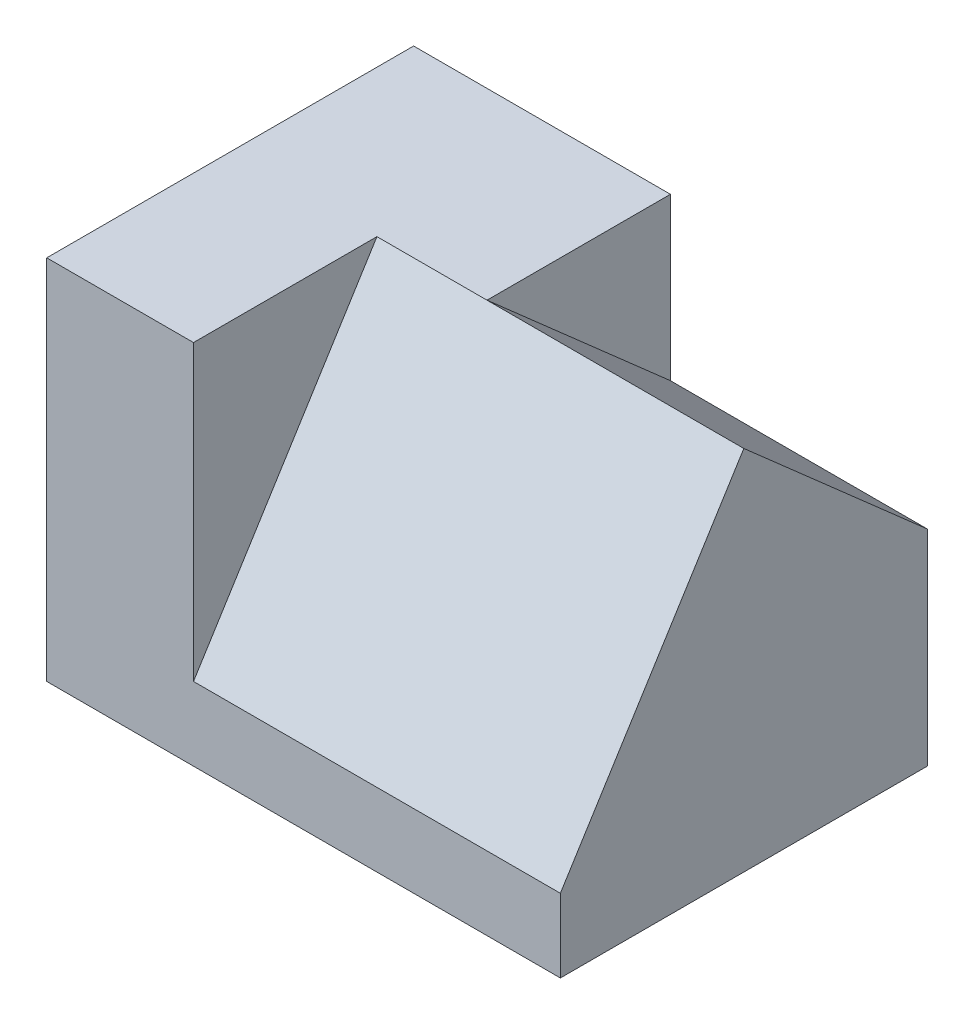
from build123d import *

# Parameters (mm, degrees)
SKETCH1_W               = 1778
SKETCH1_H               = 1270
BOSS_EXTRUDE1_DEPTH     = 1270
CUT_EXTRUDE1_DEPTH      = 2528.268090251
CUT_EXTRUDE1_DEPTH_BACK = 1270
CUT_EXTRUDE2_DEPTH      = 2528.268090251
CUT_EXTRUDE2_DEPTH_BACK = 889


with BuildPart() as part:
    # Sketch1 → Boss-Extrude1 (new body)
    with BuildSketch(Plane(origin=(0, 0, 0), x_dir=(1, 0, 0), z_dir=(0, 1, 0))):
        with Locations((889, 635)):
            Rectangle(SKETCH1_W, SKETCH1_H)
    extrude(amount=BOSS_EXTRUDE1_DEPTH)

    # Sketch2 → Cut-Extrude1 (cut, two sides: drawn at the far end of the back side and taken through both)
    with BuildSketch(Plane(origin=(1778, 0, 0), x_dir=(0, 0, -1), z_dir=(1, 0, 0)).offset(-CUT_EXTRUDE1_DEPTH_BACK)):
        Polygon((0, 254), (635, 1270), (0, 1270), align=None)
    extrude(amount=CUT_EXTRUDE1_DEPTH + CUT_EXTRUDE1_DEPTH_BACK, mode=Mode.SUBTRACT)

    # Sketch2<4> → Cut-Extrude2 (cut, two sides: drawn at the far end of the back side and taken through both)
    with BuildSketch(Plane(origin=(1778, 0, 0), x_dir=(0, 0, -1), z_dir=(1, 0, 0)).offset(-CUT_EXTRUDE2_DEPTH_BACK)):
        Polygon((1270, 1270), (635, 1270), (1270, 711.2), align=None)
    extrude(amount=CUT_EXTRUDE2_DEPTH + CUT_EXTRUDE2_DEPTH_BACK, mode=Mode.SUBTRACT)


solid = part.part
